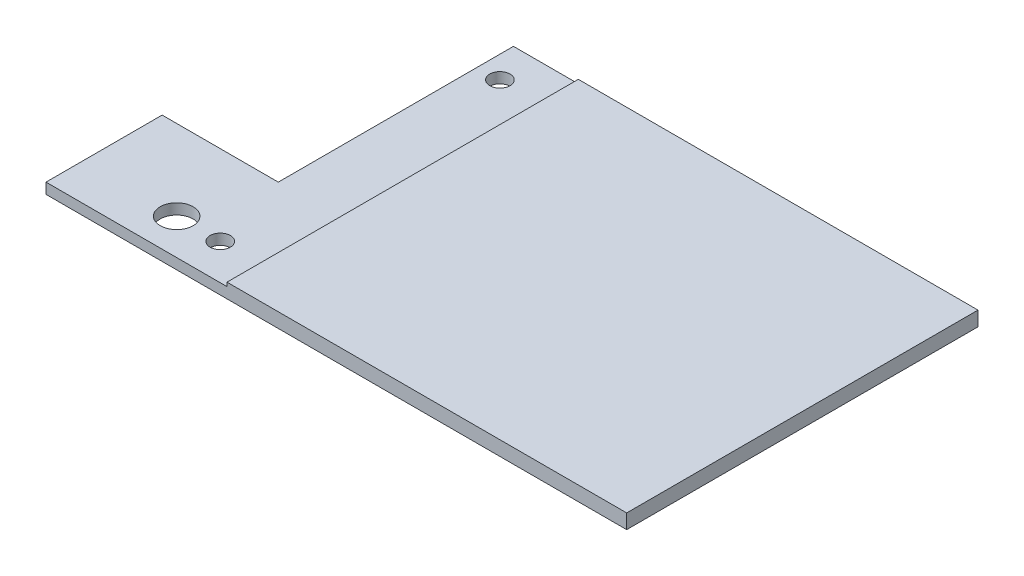
from build123d import *

# Parameters (mm, degrees)
SKETCH1_R           = 2.159
SKETCH1_R_2         = 1.330733042
BOSS_EXTRUDE1_DEPTH = 1.397
SKETCH1_3_W         = 52.448824391
SKETCH1_3_H         = 46.101
BOSS_EXTRUDE2_DEPTH = 1.905


with BuildPart() as part:
    # Sketch1 → Boss-Extrude1 (new body)
    with BuildSketch(Plane(origin=(0, 0, 0), x_dir=(1, 0, 0), z_dir=(0, 1, 0))):
        Polygon((0, 15.24), (0, 0), (76.2, 0), (76.2, 46.101), (15.24, 46.101), (15.24, 15.24), align=None)
        with Locations((12.446, 4.699)):
            Circle(SKETCH1_R, mode=Mode.SUBTRACT)
        with Locations((18.161, 4.699)):
            Circle(SKETCH1_R_2, mode=Mode.SUBTRACT)
        with Locations((18.161, 41.402)):
            Circle(SKETCH1_R_2, mode=Mode.SUBTRACT)
    extrude(amount=BOSS_EXTRUDE1_DEPTH)

    # Sketch1<3> → Boss-Extrude2 (add)
    with BuildSketch(Plane(origin=(0, 0, 0), x_dir=(1, 0, 0), z_dir=(0, 1, 0))):
        with Locations((49.975587805, 23.0505)):
            Rectangle(SKETCH1_3_W, SKETCH1_3_H)
    extrude(amount=BOSS_EXTRUDE2_DEPTH)


solid = part.part
